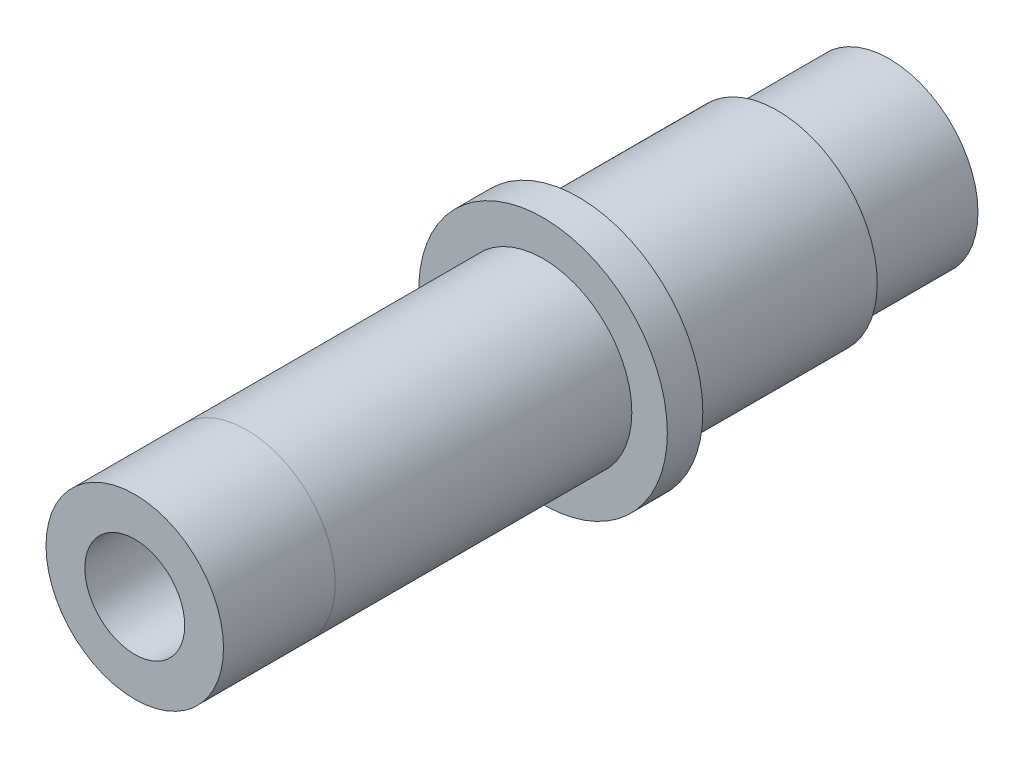
from build123d import *

# Parameters (mm, degrees)
BOSS_EXTRUDE1_DEPTH      = 30.48
BOSS_EXTRUDE1_DEPTH_BACK = 23.495
SKETCH1_R                = 6.35
SKETCH2_R                = 8.89
BOSS_EXTRUDE2_DEPTH      = 1.27
SKETCH4_R                = 7.14375
BOSS_EXTRUDE3_DEPTH      = 15.495
SKETCH5_R                = 3.571875
CUT_EXTRUDE1_DEPTH       = 56.41989557


with BuildPart() as part:
    # Sketch1 → Boss-Extrude1 (new, two sides: drawn at the far end of the back side and taken through both)
    with BuildSketch(Plane.XY.offset(-BOSS_EXTRUDE1_DEPTH_BACK)):
        Circle(SKETCH1_R)
    extrude(amount=BOSS_EXTRUDE1_DEPTH + BOSS_EXTRUDE1_DEPTH_BACK)

    # Sketch2 → Boss-Extrude2 (add, symmetric)
    with BuildSketch(Plane.XY):
        Circle(SKETCH2_R)
    extrude(amount=BOSS_EXTRUDE2_DEPTH, both=True)

    # Sketch4 → Boss-Extrude3 (add)
    with BuildSketch(Plane.XY):
        Circle(SKETCH4_R)
    extrude(amount=-BOSS_EXTRUDE3_DEPTH)

    # Sketch5 → Cut-Extrude1 (cut, through all)
    with BuildSketch(Plane.XY.offset(30.48)):
        Circle(SKETCH5_R)
    extrude(amount=-CUT_EXTRUDE1_DEPTH, mode=Mode.SUBTRACT)


solid = part.part
